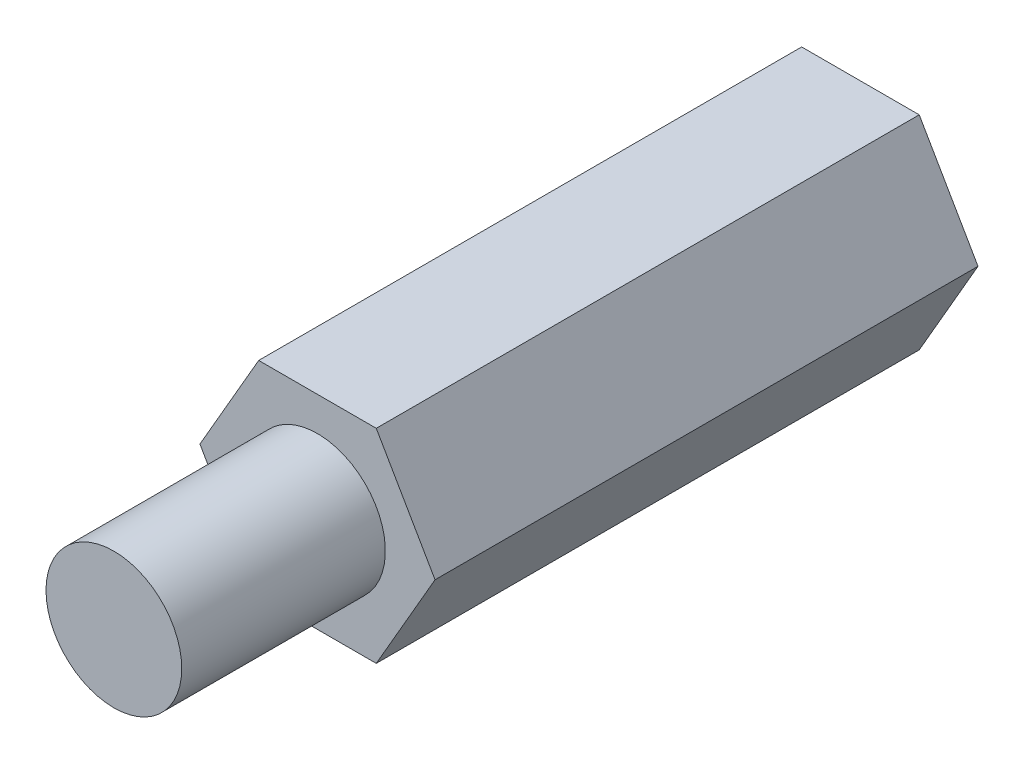
from build123d import *

# Parameters (mm, degrees)
EXTRUDE_1_DEPTH        = 16
SKETCH_2_R             = 2
EXTRUDE_2_DEPTH        = 6
HOLE_WIZARD_M4_1_D     = 3.3
HOLE_WIZARD_M4_1_DEPTH = 11.5
HOLE_WIZARD_M4_1_TIP   = 0.991420021


with BuildPart() as part:
    # 草图1 → 拉伸1 (new body)
    with BuildSketch(Plane.XY):
        Polygon((1.732050808, -3), (3.464101615, 0), (1.732050808, 3), (-1.732050808, 3), (-3.464101615, 0), (-1.732050808, -3), align=None)
    extrude(amount=EXTRUDE_1_DEPTH)

    # 草图2 → 拉伸2 (add)
    with BuildSketch(Plane.XY.offset(16)):
        with Locations(Location((0, 0, 0), (0, 0, 180))):
            Circle(SKETCH_2_R)
    extrude(amount=EXTRUDE_2_DEPTH)

    # M4 螺纹孔1
    with Locations(Plane(origin=(0, 0, 0), x_dir=(-1, 0, 0), z_dir=(0, 0, -1))):
        with Locations((0, 0)):
            Hole(HOLE_WIZARD_M4_1_D / 2, depth=HOLE_WIZARD_M4_1_DEPTH)
            with Locations((0, 0, -(HOLE_WIZARD_M4_1_DEPTH + HOLE_WIZARD_M4_1_TIP / 2))):  # 118° drill point
                Cone(0, HOLE_WIZARD_M4_1_D / 2, HOLE_WIZARD_M4_1_TIP, mode=Mode.SUBTRACT)


solid = part.part
